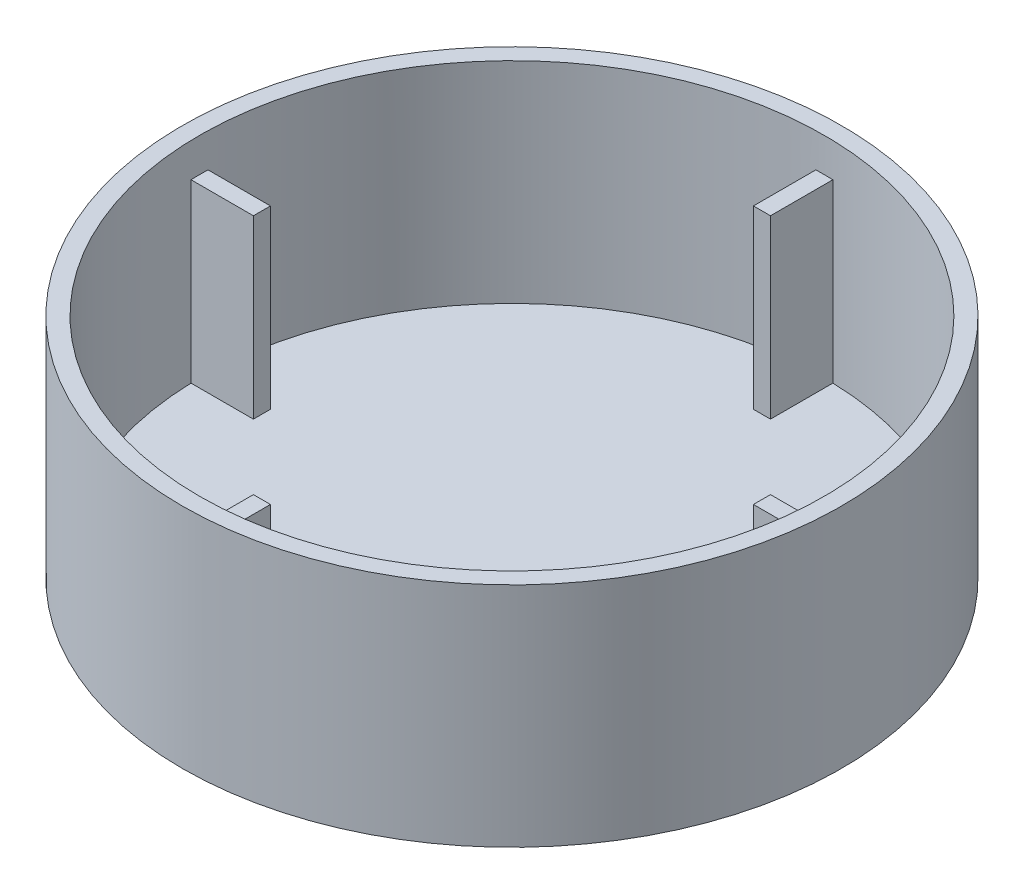
from build123d import *

# Parameters (mm, degrees)
SKETCH1_R           = 29
BOSS_EXTRUDE1_DEPTH = 20
SHELL1_T            = -1.5
SKETCH2_W           = 1.5
SKETCH2_H           = 6.087803818
SKETCH2_W_2         = 6.087803818
SKETCH2_H_2         = 1.5
BOSS_EXTRUDE2_DEPTH = 15.5


with BuildPart() as part:
    # Sketch1 → Boss-Extrude1 (new body)
    with BuildSketch(Plane(origin=(0, 0, 0), x_dir=(1, 0, 0), z_dir=(0, 1, 0))):
        with Locations(Location((0, 0, 0), (0, 0, 270))):
            Circle(SKETCH1_R)
    extrude(amount=BOSS_EXTRUDE1_DEPTH)

    # Shell1
    shell1_openings = [part.faces().sort_by_distance(p)[0] for p in [
        (0, 20, 0),
    ]]
    offset(amount=SHELL1_T, openings=shell1_openings, kind=Kind.INTERSECTION)

    # Sketch2 → Boss-Extrude2 (add)
    with BuildSketch(Plane(origin=(0, 1.5, 0), x_dir=(1, 0, 0), z_dir=(0, 1, 0))):
        with Locations((0, 25.043901909)):
            Rectangle(SKETCH2_W, SKETCH2_H)
        with Locations((25.043901909, 0)):
            Rectangle(SKETCH2_W_2, SKETCH2_H_2)
        with Locations((0, -25.043901909)):
            Rectangle(SKETCH2_W, SKETCH2_H)
        with Locations((-25.043901909, 0)):
            Rectangle(SKETCH2_W_2, SKETCH2_H_2)
    extrude(amount=BOSS_EXTRUDE2_DEPTH)


solid = part.part
